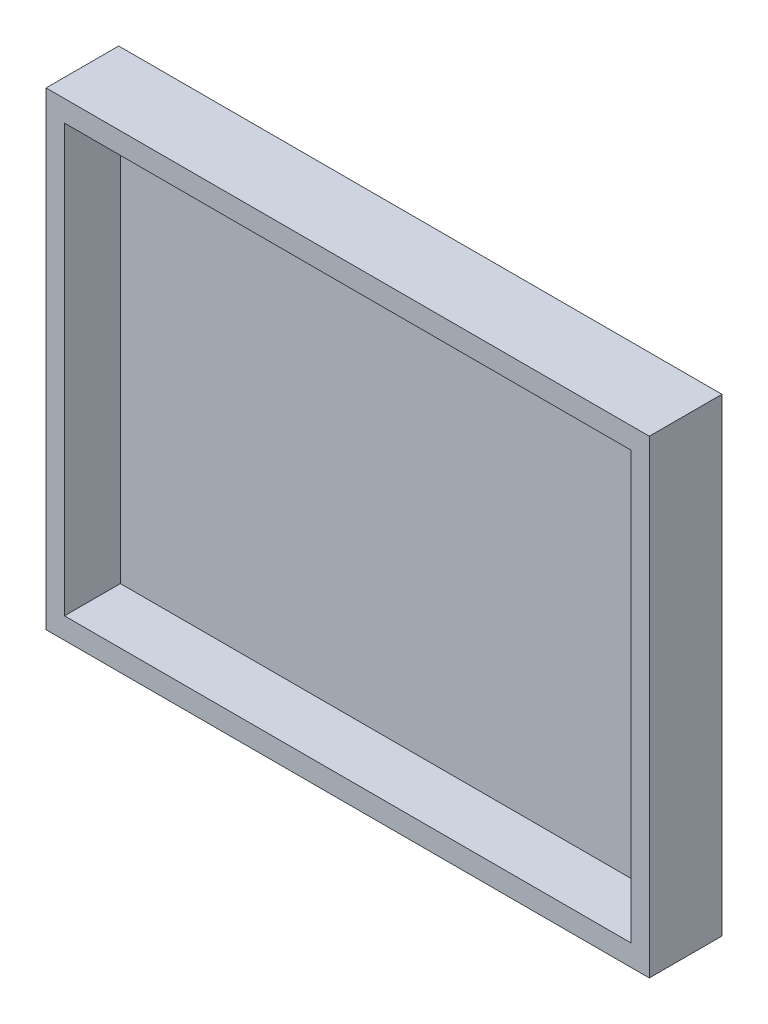
from build123d import *

# Parameters (mm, degrees)
ESQUISSE1_R             = 7.5
ESQUISSE1_R_2           = 4.5
BOSS_EXTRU_1_DEPTH      = 10
ESQUISSE2_W             = 54
ESQUISSE2_H             = 42
BOSS_EXTRU_2_DEPTH      = 6.5
ESQUISSE4_W             = 50.7
ESQUISSE4_H             = 38.2
ENL_V_MAT_EXTRU_2_DEPTH = 5


with BuildPart() as part:
    # Esquisse1 → Boss.-Extru.1 (new body)
    with BuildSketch(Plane.XY):
        Circle(ESQUISSE1_R)
        Circle(ESQUISSE1_R_2, mode=Mode.SUBTRACT)
    extrude(amount=BOSS_EXTRU_1_DEPTH)

    # Esquisse2 → Boss.-Extru.2 (add)
    with BuildSketch(Plane.XY.offset(10)):
        Rectangle(ESQUISSE2_W, ESQUISSE2_H)
    extrude(amount=BOSS_EXTRU_2_DEPTH)

    # Esquisse4 → Enlèv. mat.-Extru.2 (cut)
    with BuildSketch(Plane.XY.offset(16.5)):
        Rectangle(ESQUISSE4_W, ESQUISSE4_H)
    extrude(amount=-ENL_V_MAT_EXTRU_2_DEPTH, mode=Mode.SUBTRACT)


solid = part.part
